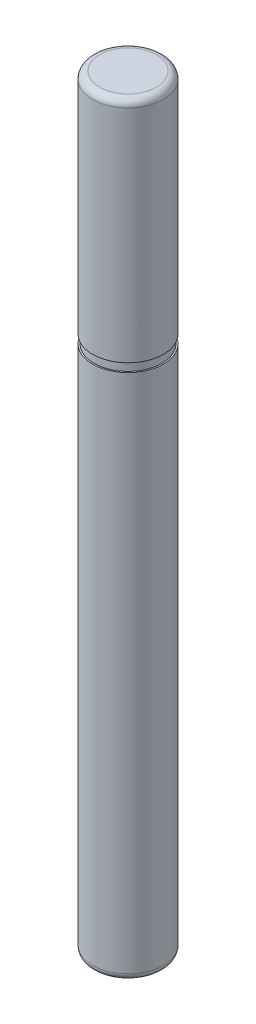
from build123d import *

# Parameters (mm, degrees)
SKETCH1_R           = 2.5
BOSS_EXTRUDE1_DEPTH = 27
CUT_EXTRUDE2_START  = -9.5
CUT_EXTRUDE2_DEPTH  = 2.5
CUT_EXTRUDE3_START  = -52.5
CUT_EXTRUDE3_DEPTH  = 6
FILLET1_R           = 0.5
SKETCH5_W           = 2
SKETCH5_H           = 0.6


with BuildPart() as part:
    # Sketch1 → Boss-Extrude1 (new, symmetric)
    with BuildSketch(Plane.XZ):
        Circle(SKETCH1_R)
    extrude(amount=BOSS_EXTRUDE1_DEPTH, both=True)

    # Sketch4 → Cut-Extrude2 (cut)
    with BuildSketch(Plane(origin=(0, 27, 0), x_dir=(1, 0, 0), z_dir=(0, 1, 0)).offset(CUT_EXTRUDE2_START)):
        with BuildLine():
            Line((-1.5, 2), (1.5, 2))
            ThreePointArc((1.5, 2), (0, 2.5), (-1.5, 2))
        make_face()
    extrude(amount=CUT_EXTRUDE2_DEPTH, mode=Mode.SUBTRACT)

    # Sketch4<2> → Cut-Extrude3 (cut)
    with BuildSketch(Plane(origin=(0, 27, 0), x_dir=(1, 0, 0), z_dir=(0, 1, 0)).offset(CUT_EXTRUDE3_START)):
        with BuildLine():
            Line((-1.5, 2), (1.5, 2))
            ThreePointArc((1.5, 2), (0, 2.5), (-1.5, 2))
        make_face()
    extrude(amount=CUT_EXTRUDE3_DEPTH, mode=Mode.SUBTRACT)

    # Fillet1
    fillet1_edges = [part.edges().sort_by_distance(p)[0] for p in [
        (-2.5, -27, 0),
        (-2.5, 27, 0),
    ]]
    fillet(fillet1_edges, radius=FILLET1_R)

    # Sketch5 → Cut-Revolve2 (revolve, cut)
    with BuildSketch(Plane.XY):
        with Locations((3.4, 10.6)):
            Rectangle(SKETCH5_W, SKETCH5_H)
    revolve(axis=Axis((0, 0, 0), (0, 1, 0)), mode=Mode.SUBTRACT)


solid = part.part
